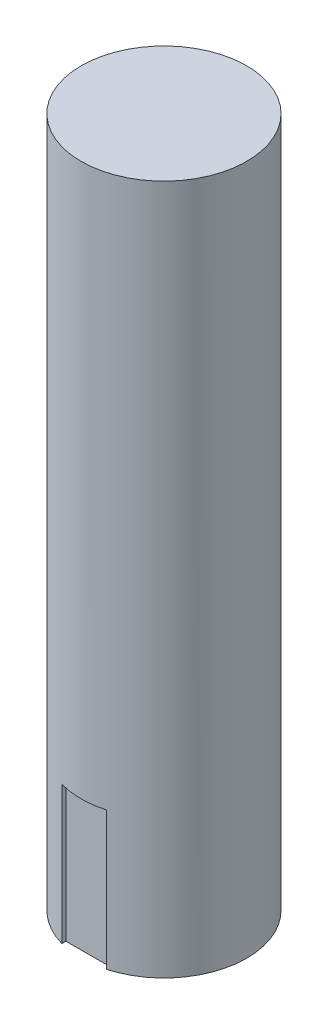
from build123d import *

# Parameters (mm, degrees)
SKETCH2_R           = 30
BOSS_EXTRUDE1_DEPTH = 125
CUT_EXTRUDE1_START  = -50
CUT_EXTRUDE1_DEPTH  = 50


with BuildPart() as part:
    # Sketch2 → Boss-Extrude1 (new, symmetric)
    with BuildSketch(Plane(origin=(0, 0, 0), x_dir=(1, 0, 0), z_dir=(0, 1, 0))):
        with Locations(Location((0, 0, 0), (0, 0, 270))):
            Circle(SKETCH2_R)
    extrude(amount=BOSS_EXTRUDE1_DEPTH, both=True)

    # Sketch3 → Cut-Extrude1 (cut)
    with BuildSketch(Plane.XZ.offset(125).offset(CUT_EXTRUDE1_START)):
        with BuildLine():
            ThreePointArc((-8.095335695, 28.887117197), (0, 30), (8.095335695, 28.887117197))
            Line((8.095335695, 28.887117197), (8.095335695, 34.42))
            Line((8.095335695, 34.42), (-8.095335695, 34.42))
            Line((-8.095335695, 34.42), (-8.095335695, 28.887117197))
        make_face()
        with BuildLine():
            Line((-8.095335695, 27.42), (8.095335695, 27.42))
            Line((8.095335695, 27.42), (8.095335695, 28.887117197))
            ThreePointArc((8.095335695, 28.887117197), (0, 30), (-8.095335695, 28.887117197))
            Line((-8.095335695, 28.887117197), (-8.095335695, 27.42))
        make_face()
    extrude(amount=CUT_EXTRUDE1_DEPTH, mode=Mode.SUBTRACT)


solid = part.part
